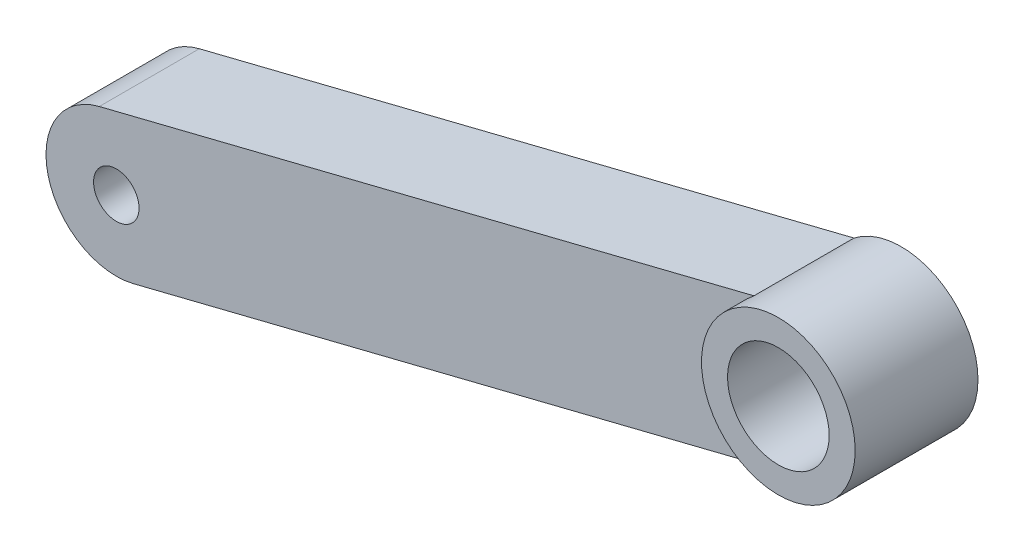
from build123d import *

# Parameters (mm, degrees)
SKETCH3_R           = 4.2545
SKETCH3_R_2         = 1.905
BOSS_EXTRUDE1_DEPTH = 4.191
SKETCH4_R           = 6.436168178
SKETCH4_R_2         = 4.2545
BOSS_EXTRUDE2_DEPTH = 6.096
SKETCH6_R           = 6.436168178
CUT_EXTRUDE1_DEPTH  = 1.905


with BuildPart() as part:
    # Sketch3 → Boss-Extrude1 (new, symmetric)
    with BuildSketch(Plane.XY.offset(6.35)):
        with BuildLine():
            Line((-6.194175956, -60.322809185), (-63.551262793, -74.638203042))
            ThreePointArc((-63.551262793, -74.638203042), (-70.689896022, -70.351217901), (-66.402910881, -63.212584672))
            Line((-66.402910881, -63.212584672), (-9.045824044, -48.897190815))
            ThreePointArc((-9.045824044, -48.897190815), (-1.907190815, -53.184175956), (-6.194175956, -60.322809185))
        make_face()
        with Locations((-7.62, -54.61)):
            Circle(SKETCH3_R, mode=Mode.SUBTRACT)
        with Locations((-64.977086837, -68.925393857)):
            Circle(SKETCH3_R_2, mode=Mode.SUBTRACT)
    extrude(amount=BOSS_EXTRUDE1_DEPTH, both=True)

    # Sketch4 → Boss-Extrude2 (add, symmetric)
    with BuildSketch(Plane.XY.offset(6.35)):
        with Locations((-7.62, -54.61)):
            Circle(SKETCH4_R)
        with Locations((-7.62, -54.61)):
            Circle(SKETCH4_R_2, mode=Mode.SUBTRACT)
    extrude(amount=BOSS_EXTRUDE2_DEPTH, both=True)

    # Sketch6 → Cut-Extrude1 (cut)
    with BuildSketch(Plane(origin=(0, 0, 2.159), x_dir=(-1, 0, 0), z_dir=(0, 0, -1))):
        with Locations(Location((7.62, -54.61, 0), (0, 0, 52.168968889))):
            Circle(SKETCH6_R)
    extrude(amount=CUT_EXTRUDE1_DEPTH, mode=Mode.SUBTRACT)


solid = part.part
